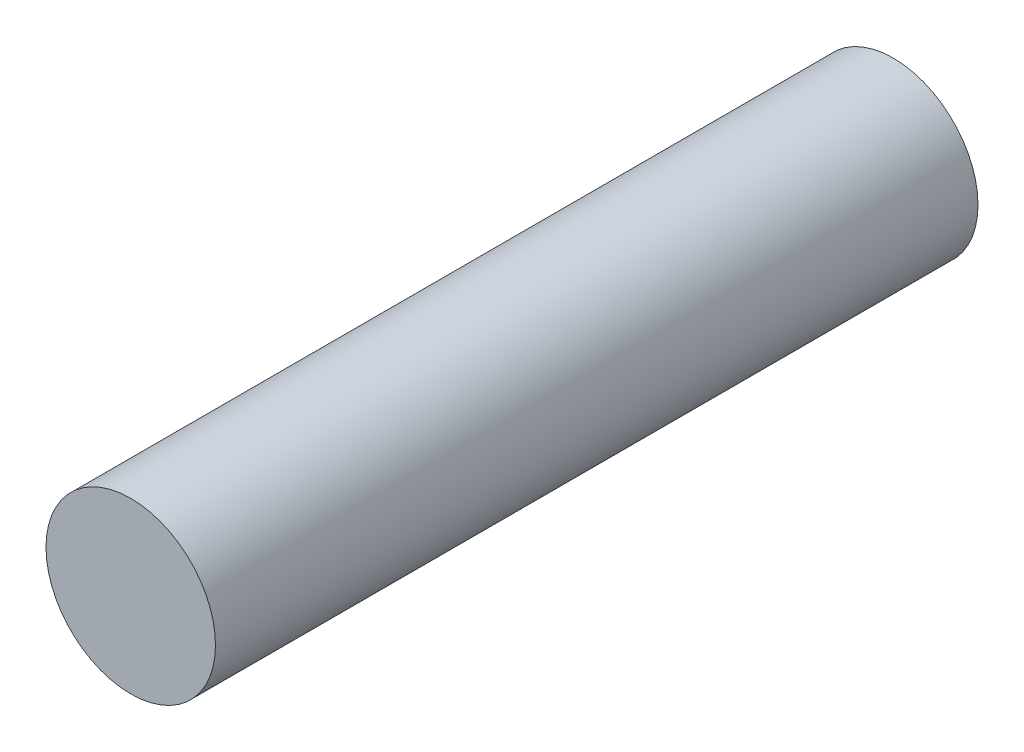
from build123d import *

# Parameters (mm, degrees)
SKETCH_1_W = 180
SKETCH_1_H = 20


with BuildPart() as part:
    # 草图1 → 旋转1 (revolve)
    with BuildSketch(Plane(origin=(0, 0, 0), x_dir=(0, 0, -1), z_dir=(1, 0, 0)), mode=Mode.PRIVATE) as revolve_1_sk:
        with Locations((90, 10)):
            Rectangle(SKETCH_1_W, SKETCH_1_H)
    revolve(revolve_1_sk.sketch.rotate(Axis((0, 0, 0), (0, 0, -1)), 90), axis=Axis((0, 0, 0), (0, 0, -1)))


solid = part.part
